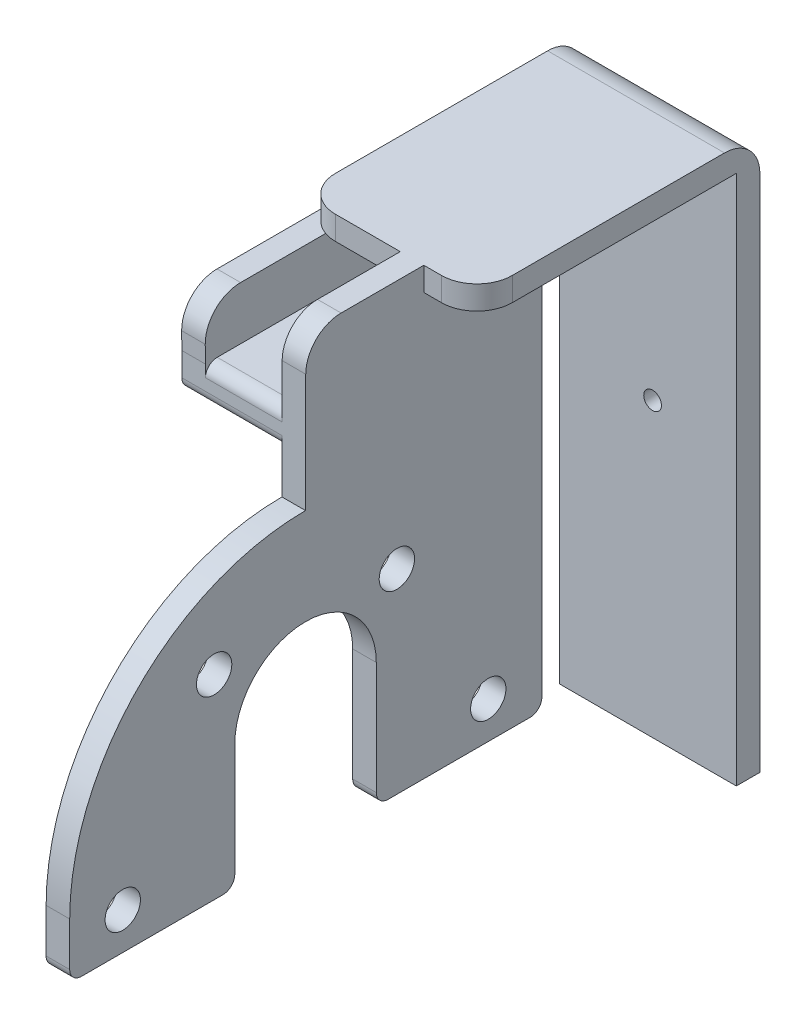
from build123d import *

# Parameters (mm, degrees)
BOSS_EXTRUDE1_DEPTH      = 2
BOSS_EXTRUDE2_DEPTH      = 2
SKETCH3_R                = 6.000000000000001
CUT_EXTRUDE1_DEPTH       = 2
SKETCH4_R                = 1.5000000000000009
SKETCH4_R_2              = 1.5000000000000042
CUT_EXTRUDE2_DEPTH       = 3
SKETCH5_R                = 1.5000000000000004
SKETCH5_R_2              = 1.5000000000000042
CUT_EXTRUDE3_DEPTH       = 3
CUT_EXTRUDE4_DEPTH       = 3
CUT_EXTRUDE5_DEPTH       = 3
CUT_EXTRUDE6_DEPTH       = 3
SKETCH9_R                = 1.5000000000000042
CUT_EXTRUDE8_DEPTH       = 3
SKETCH10_R               = 1.5000000000000042
CUT_EXTRUDE9_DEPTH       = 3
CUT_EXTRUDE10_DEPTH      = 240.38671642344738
CUT_EXTRUDE10_DEPTH_BACK = 240.38671642344738
SKETCH12_R               = 1.4999999999999998
SKETCH12_R_2             = 1.5000000000000002
SKETCH12_R_3             = 1.5000000000000013
SKETCH12_R_4             = 1.5
SKETCH12_R_5             = 1.5000000000000009
BOSS_EXTRUDE7_START      = 2
SKETCH13_R               = 1.5000000000000009
SKETCH13_R_2             = 1.5000000000000024
BOSS_EXTRUDE7_DEPTH      = 2
BOSS_EXTRUDE8_START      = -6.5
SKETCH14_W               = 24
SKETCH14_H               = 2
BOSS_EXTRUDE8_DEPTH      = 15
SKETCH15_W               = 15.000000000000007
SKETCH15_H               = 2
BOSS_EXTRUDE9_DEPTH      = 45
CUT_EXTRUDE11_DEPTH      = 243.1136096959442
SKETCH17_W               = 185.56969898313426
SKETCH17_H               = 96.24266996951368
CUT_EXTRUDE13_DEPTH      = 211.18448651258493
SKETCH18_R               = 1.5000000000000042
CUT_EXTRUDE14_DEPTH      = 10
BOSS_EXTRUDE10_DEPTH     = 8.5
FILLET1_R                = 3
FILLET2_R                = 3
FILLET3_R                = 3
SKETCH21_W               = 15.000000000000007
SKETCH21_H               = 44.000000000000014
SKETCH21_R               = 0.7499999999999987
BOSS_EXTRUDE11_DEPTH     = 2
BOSS_EXTRUDE12_DEPTH     = 2
FILLET4_R                = 3
FILLET5_R                = 1
FILLET6_R                = 1


with BuildPart() as part:
    # Sketch1 → Boss-Extrude1 (new body)
    with BuildSketch(Plane(origin=(0, 0, 0), x_dir=(1, 0, 0), z_dir=(0, 1, 0))):
        Polygon((55, -26.999999999999986), (55, 27.00000000000001), (-55, 26.999999999999996), (-55, -27), (-38.49999999999998, -134.00000000000006), (38.50000000000002, -134.00000000000003), align=None)
        Polygon((64.00000000000001, -159.00000000000003), (-63.99999999999996, -159.00000000000003), (-63.999999999999986, -134.00000000000006), (64, -134.00000000000003), align=None)
        Polygon((31.00000000000004, -159.00000000000006), (-30.99999999999999, -159.00000000000006), (-30.999999999999982, -172.00000000000006), (31.000000000000018, -172.00000000000006), align=None)
        Polygon((64.00000000000006, -172.00000000000003), (-64, -172.00000000000006), (-63.999999999999986, -203), (64.00000000000001, -203.00000000000003), align=None)
    extrude(amount=BOSS_EXTRUDE1_DEPTH)

    # Sketch2 → Boss-Extrude2 (add)
    with BuildSketch(Plane.ZY.offset(55)):
        with BuildLine():
            ThreePointArc((-22.999999999999996, 24), (-2.999999999999998, 44), (16.999999999999996, 24))
            Line((16.999999999999996, 24), (-22.999999999999996, 24))
        make_face()
        Polygon((-22.999999999999996, 24), (-22.999999999999996, 2.000000000000001), (17.000000000000004, 2.0000000000000053), (17.000000000000004, 24), align=None)
    boss_extrude2 = extrude(amount=-BOSS_EXTRUDE2_DEPTH)

    # Sketch3 → Cut-Extrude1 (cut)
    with BuildSketch(Plane.ZY.offset(55)):
        with Locations((-2.9999999999999956, 16)):
            Circle(SKETCH3_R)
    cut_extrude1 = extrude(amount=-CUT_EXTRUDE1_DEPTH, mode=Mode.SUBTRACT)

    # Mirror1: Boss-Extrude2 across plane
    add(boss_extrude2.mirror(Plane(origin=(0, 0, 0), x_dir=(0, 0, 1), z_dir=(1, 0, 0))))

    # Mirror2: Cut-Extrude1 across plane
    add(cut_extrude1.mirror(Plane(origin=(0, 0, 0), x_dir=(0, 0, 1), z_dir=(1, 0, 0))), mode=Mode.SUBTRACT)

    # Sketch4 → Cut-Extrude2 (cut)
    with BuildSketch(Plane(origin=(0, 2, 0), x_dir=(1, 0, 0), z_dir=(0, 1, 0))):
        with Locations(Location((-31.999999999999993, -32.999999999999986, 0), (0, 0, 270))):
            Circle(SKETCH4_R)
        with Locations(Location((-31.999999999999993, -103.00000000000001, 0), (0, 0, 270))):
            Circle(SKETCH4_R)
        with Locations(Location((32.00000000000001, -103, 0), (0, 0, 270))):
            Circle(SKETCH4_R_2)
        with Locations(Location((32.00000000000001, -32.999999999999964, 0), (0, 0, 270))):
            Circle(SKETCH4_R_2)
    extrude(amount=-CUT_EXTRUDE2_DEPTH, mode=Mode.SUBTRACT)

    # Sketch5 → Cut-Extrude3 (cut)
    with BuildSketch(Plane(origin=(0, 2, 0), x_dir=(1, 0, 0), z_dir=(0, 1, 0))):
        with Locations(Location((0, -196, 0), (0, 0, 270))):
            Circle(SKETCH5_R)
        with Locations(Location((-42, -196, 0), (0, 0, 270))):
            Circle(SKETCH5_R_2)
        with Locations(Location((42, -195.99999999999997, 0), (0, 0, 270))):
            Circle(SKETCH5_R_2)
    extrude(amount=-CUT_EXTRUDE3_DEPTH, mode=Mode.SUBTRACT)

    # Sketch6 → Cut-Extrude4 (cut)
    with BuildSketch(Plane(origin=(0, 2, 0), x_dir=(1, 0, 0), z_dir=(0, 1, 0))):
        with BuildLine():
            Line((-39, -172.00000000000006), (-39, -178.99999999999997))
            ThreePointArc((-39, -178.99999999999997), (-41.92893218813453, -186.0710678118655), (-49.00000000000007, -189.00000000000003))
            Line((-49.00000000000007, -189.00000000000003), (-63.999999999999986, -189.00000000000003))
            Line((-63.999999999999986, -189.00000000000003), (-64, -172.00000000000009))
            Line((-64, -172.00000000000009), (-39, -172.00000000000006))
        make_face()
        with BuildLine():
            Line((64, -172.00000000000009), (39, -172.00000000000009))
            Line((39, -172.00000000000009), (39, -179))
            ThreePointArc((39, -179), (41.928932188134524, -186.07106781186553), (49.00000000000007, -189.00000000000003))
            Line((49.00000000000007, -189.00000000000003), (63.999999999999986, -189.00000000000003))
            Line((63.999999999999986, -189.00000000000003), (64, -172.00000000000009))
        make_face()
    extrude(amount=-CUT_EXTRUDE4_DEPTH, mode=Mode.SUBTRACT)

    # Sketch7 → Cut-Extrude5 (cut)
    with BuildSketch(Plane(origin=(0, 2, 0), x_dir=(1, 0, 0), z_dir=(0, 1, 0))):
        with BuildLine():
            Line((-63.999999999999986, -203), (-50.09999999999989, -203))
            ThreePointArc((-50.09999999999989, -203), (-59.92878425849301, -198.92878425849304), (-63.99999999999999, -189.0999999999999))
            Line((-63.999999999999986, -189.0999999999999), (-63.999999999999986, -203))
        make_face()
        with BuildLine():
            ThreePointArc((64.00000000000001, -189.09999999999988), (59.92878425849304, -198.928784258493), (50.099999999999916, -203))
            Line((50.099999999999916, -203), (64.00000000000001, -203))
            Line((64.00000000000001, -203), (64.00000000000001, -189.09999999999988))
        make_face()
    extrude(amount=-CUT_EXTRUDE5_DEPTH, mode=Mode.SUBTRACT)

    # Sketch8 → Cut-Extrude6 (cut)
    with BuildSketch(Plane(origin=(0, 2, 0), x_dir=(1, 0, 0), z_dir=(0, 1, 0))):
        with BuildLine():
            Line((-31.149343986878943, -172.00000000000006), (-39, -172.00000000000006))
            Line((-39, -172.00000000000006), (-38.99999999999999, -178.99999999999997))
            ThreePointArc((-39, -178.99999999999997), (-39.00000430772996, -179.009281949184), (-39.00001723091613, -179.01856389037115))
            ThreePointArc((-39.00001723091618, -179.01856389037115), (-36.414638600380236, -174.01046074526764), (-31.149343986878943, -172.00000000000006))
        make_face()
        with BuildLine():
            Line((39, -179), (39, -172.00000000000009))
            Line((39.00000000000004, -172), (31.149343986878986, -172))
            ThreePointArc((31.149343986878986, -172), (36.41463860038014, -174.01046074526744), (39.00001723091619, -179.01856389037067))
            ThreePointArc((39.00001723091614, -179.01856389037067), (39.000004307729974, -179.00928194918376), (39.000000000000014, -179))
        make_face()
    extrude(amount=-CUT_EXTRUDE6_DEPTH, mode=Mode.SUBTRACT)

    # Sketch9 → Cut-Extrude8 (cut)
    with BuildSketch(Plane(origin=(0, 2, 0), x_dir=(1, 0, 0), z_dir=(0, 1, 0))):
        with BuildLine():
            Line((-65.7442014947963, -159.00000000000003), (-38.49999999999998, -159.00000000000003))
            Line((-38.49999999999998, -159.00000000000003), (-58.499999999999986, -153.64101615137747))
            ThreePointArc((-58.499999999999986, -153.64101615137747), (-63.97949441454555, -146.5), (-58.49999999999998, -139.35898384862253))
            Line((-58.49999999999998, -139.3589838486225), (-38.49999999999998, -134.00000000000009))
            Line((-38.49999999999998, -134.00000000000009), (-65.7442014947963, -134.00000000000009))
            Line((-65.7442014947963, -134.00000000000009), (-65.7442014947963, -159.00000000000003))
        make_face()
        with BuildLine():
            Line((38.49999999999998, -159.00000000000003), (65.55068988792617, -159.00000000000003))
            Line((65.55068988792617, -159.00000000000003), (65.55068988792617, -134.00000000000009))
            Line((65.55068988792617, -134.00000000000009), (38.49999999999998, -134.00000000000009))
            Line((38.49999999999998, -134.00000000000009), (58.49999999999998, -139.3589838486225))
            ThreePointArc((58.49999999999998, -139.35898384862253), (63.97949441454555, -146.5), (58.499999999999986, -153.64101615137747))
            Line((58.499999999999986, -153.64101615137747), (38.49999999999998, -159.00000000000003))
        make_face()
        with Locations(Location((-58.97949441454556, -146.5, 0), (0, 0, 270))):
            Circle(SKETCH9_R)
        with Locations(Location((-43.97949441454556, -140.5, 0), (0, 0, 270))):
            Circle(SKETCH9_R)
        with Locations(Location((-43.979494414545556, -152.5, 0), (0, 0, 270))):
            Circle(SKETCH9_R)
        with Locations(Location((43.979494414545556, -152.5, 0), (0, 0, 270))):
            Circle(SKETCH9_R)
        with Locations(Location((43.97949441454556, -140.5, 0), (0, 0, 270))):
            Circle(SKETCH9_R)
        with Locations(Location((58.97949441454556, -146.5, 0), (0, 0, 270))):
            Circle(SKETCH9_R)
    extrude(amount=-CUT_EXTRUDE8_DEPTH, mode=Mode.SUBTRACT)

    # Sketch10 → Cut-Extrude9 (cut)
    with BuildSketch(Plane(origin=(0, 2, 0), x_dir=(1, 0, 0), z_dir=(0, 1, 0))):
        with Locations(Location((-13.999999999999984, -122.97951269366077, 0), (0, 0, 270))):
            Circle(SKETCH10_R)
        with Locations(Location((-13.99999999999998, -132.97951269366075, 0), (0, 0, 270))):
            Circle(SKETCH10_R)
        with Locations(Location((34.000000000000014, -122.97951269366077, 0), (0, 0, 270))):
            Circle(SKETCH10_R)
        with Locations(Location((34.000000000000014, -132.97951269366075, 0), (0, 0, 270))):
            Circle(SKETCH10_R)
    extrude(amount=-CUT_EXTRUDE9_DEPTH, mode=Mode.SUBTRACT)

    # Sketch12 → Cut-Extrude10 (cut, two sides: drawn at the far end of the back side and taken through both)
    with BuildSketch(Plane(origin=(55, 0, 0), x_dir=(0, 0, -1), z_dir=(1, 0, 0)).offset(-CUT_EXTRUDE10_DEPTH_BACK)):
        with Locations((-4.750000000000004, 9.000000000000002)):
            Circle(SKETCH12_R)
        with Locations((10.749999999999996, 9.000000000000007)):
            Circle(SKETCH12_R_2)
        with BuildLine():
            ThreePointArc((8.999999999999975, 29.840000000000014), (2.9999999999999827, 35.83999999999998), (-3.000000000000003, 29.840000000000007))
            Line((-3.000000000000004, 29.840000000000007), (-3.0000000000000053, 16))
            ThreePointArc((-3.000000000000004, 16), (2.9999999999999964, 10), (8.999999999999998, 16))
            Line((8.999999999999998, 16), (8.999999999999973, 29.840000000000014))
        make_face()
        with Locations((-4.750000000000004, 35.84)):
            Circle(SKETCH12_R_3)
        with Locations((10.749999999999996, 35.84000000000001)):
            Circle(SKETCH12_R_4)
        with Locations((-12.500000000000004, 22.42)):
            Circle(SKETCH12_R_5)
        with Locations((18.499999999999996, 22.42000000000001)):
            Circle(SKETCH12_R_5)
    extrude(amount=CUT_EXTRUDE10_DEPTH + CUT_EXTRUDE10_DEPTH_BACK, mode=Mode.SUBTRACT)

    # Sketch13 → Boss-Extrude7 (add)
    # profile 1 of 2: a face of its own
    with BuildSketch(Plane(origin=(55, 0, 0), x_dir=(0, 0, -1), z_dir=(1, 0, 0)).offset(BOSS_EXTRUDE7_START)):
        with BuildLine():
            Line((-17.000000000000004, 24), (-17.000000000000004, 19.28348423041724))
            Line((-17.000000000000004, 19.28348423041724), (-3.0000000000000053, 19.28348423041724))
            Line((-3.000000000000005, 19.28348423041724), (-3.000000000000004, 29.840000000000007))
            ThreePointArc((-3.000000000000006, 29.840000000000007), (2.9999999999999787, 35.84), (8.999999999999972, 29.840000000000014))
            Line((8.999999999999973, 29.840000000000014), (8.999999999999993, 19.28348423041724))
            Line((8.999999999999993, 19.28348423041724), (22.999999999999996, 19.283484230417237))
            Line((22.999999999999996, 19.283484230417237), (22.999999999999996, 24))
            ThreePointArc((22.999999999999996, 24), (17.142135623730947, 38.14213562373095), (2.999999999999998, 44))
            ThreePointArc((2.999999999999998, 44), (-11.142135623730953, 38.14213562373095), (-17.000000000000004, 24.000000000000004))
        make_face()
        with Locations((-12.500000000000004, 22.42)):
            Circle(SKETCH13_R, mode=Mode.SUBTRACT)
        with Locations((18.499999999999996, 22.42000000000001)):
            Circle(SKETCH13_R, mode=Mode.SUBTRACT)
        with Locations((-4.750000000000004, 35.84)):
            Circle(SKETCH13_R, mode=Mode.SUBTRACT)
        with Locations((10.749999999999996, 35.84000000000001)):
            Circle(SKETCH13_R_2, mode=Mode.SUBTRACT)
    # profile 2 of 2: a face of its own
    with BuildSketch(Plane(origin=(55, 0, 0), x_dir=(0, 0, -1), z_dir=(1, 0, 0)).offset(BOSS_EXTRUDE7_START)):
        with BuildLine():
            Line((22.999999999999996, 24), (22.999999999999996, 19.283484230417237))
            Line((22.999999999999996, 19.283484230417237), (23.046815154055327, 19.283484230417237))
            Line((23.046815154055327, 19.283484230417237), (23.04681515405532, 57))
            Line((23.04681515405532, 57), (3.0234075770276583, 57))
            Line((3.023407577027657, 57), (2.999999999999997, 44))
            ThreePointArc((2.999999999999998, 44), (17.142135623730947, 38.14213562373095), (22.999999999999996, 24))
        make_face()
    extrude(amount=-BOSS_EXTRUDE7_DEPTH)

    # Sketch14 → Boss-Extrude8 (add)
    with BuildSketch(Plane.ZY.offset(-55).offset(BOSS_EXTRUDE8_START)):
        with Locations((-25.03511136554149, 56.00000000000001)):
            Rectangle(SKETCH14_W, SKETCH14_H)
    extrude(amount=BOSS_EXTRUDE8_DEPTH)

    # Sketch15 → Boss-Extrude9 (add)
    with BuildSketch(Plane.XZ.offset(-55)):
        with Locations((54, -36.03511136554149)):
            Rectangle(SKETCH15_W, SKETCH15_H)
    extrude(amount=BOSS_EXTRUDE9_DEPTH)

    # Sketch16 → Cut-Extrude11 (cut, through all)
    with BuildSketch(Plane.ZY.offset(-55)):
        Polygon((-35.92021187003197, 46.46920068706199), (-36.717575013579555, -14.58603430458196), (219.6312484084681, -17.93387341643705), (219.6312484084681, 46.469200687062), align=None)
    extrude(amount=CUT_EXTRUDE11_DEPTH, mode=Mode.SUBTRACT)


with BuildPart() as cut_extrude11_piece_1:
    # of the separate pieces the step leaves, piece 1, a body of its own (cut_extrude11_pieces)
    add(part.part.solids().sort_by_distance((57, 19.28348423, -9))[0])

    # Sketch18 → Cut-Extrude14 (cut)
    with BuildSketch(Plane(origin=(0, 0, -37.03511136554149), x_dir=(-1, 0, 0), z_dir=(0, 0, -1))):
        with Locations((-54.4, 34.78000000000001)):
            Circle(SKETCH18_R)
    extrude(amount=-CUT_EXTRUDE14_DEPTH, mode=Mode.SUBTRACT)

    # Sketch19 → Boss-Extrude10 (add)
    with BuildSketch(Plane.ZY.offset(-55)):
        with BuildLine():
            Line((-3.0117037885138274, 50.5), (-3.006302039968982, 47.5))
            Line((-3.006302039968982, 47.5), (-16.04681515405532, 47.50000000000001))
            ThreePointArc((-16.04681515405532, 47.50000000000001), (-18.875242278801508, 46.32842712474619), (-20.04681515405532, 43.5))
            Line((-20.04681515405532, 43.5), (-20.04681515405532, 41.96229343982267))
            ThreePointArc((-20.04681515405532, 41.96229343982267), (-20.339708372868774, 41.25518665863612), (-21.046815154055327, 40.962293439822666))
            Line((-21.046815154055327, 40.962293439822666), (-22.046815154055313, 40.962293439822666))
            ThreePointArc((-22.046815154055313, 40.962293439822666), (-22.75392193524187, 41.25518665863611), (-23.046815154055324, 41.96229343982267))
            Line((-23.046815154055324, 41.96229343982267), (-23.046815154055317, 46.5))
            ThreePointArc((-23.046815154055317, 46.5), (-21.875242278801515, 49.3284271247462), (-19.04681515405532, 50.50000000000001))
            Line((-19.04681515405532, 50.50000000000001), (-3.0117037885138274, 50.5))
        make_face()
    extrude(amount=BOSS_EXTRUDE10_DEPTH)

    # Fillet1
    fillet1_edges = [cut_extrude11_piece_1.edges().sort_by_distance(p)[0] for p in [
        (56, 57, -3.0234075770276574),
    ]]
    fillet(fillet1_edges, radius=FILLET1_R)

    # Fillet2
    fillet2_edges = [cut_extrude11_piece_1.edges().sort_by_distance(p)[0] for p in [
        (61.5, 56, -13.035111365541487),
        (46.5, 56, -13.035111365541487),
    ]]
    fillet(fillet2_edges, radius=FILLET2_R)

    # Fillet3
    fillet3_edges = [cut_extrude11_piece_1.edges().sort_by_distance(p)[0] for p in [
        (54, 57.00000000000001, -37.03511136554149),
    ]]
    fillet(fillet3_edges, radius=FILLET3_R)

    # Sketch21 → Boss-Extrude11 (add)
    with BuildSketch(Plane(origin=(0, 0, -37.03511136554149), x_dir=(-1, 0, 0), z_dir=(0, 0, -1))):
        with Locations((-54, 32)):
            Rectangle(SKETCH21_W, SKETCH21_H)
        with Locations((-54.4, 34.78000000000001)):
            Circle(SKETCH21_R, mode=Mode.SUBTRACT)
    extrude(amount=-BOSS_EXTRUDE11_DEPTH)

    # Sketch22 → Boss-Extrude12 (add)
    with BuildSketch(Plane.ZY.offset(-46.5)):
        with BuildLine():
            Line((-16.035111365541486, 55), (-23.04681515405532, 55))
            Line((-23.04681515405532, 55), (-23.046815154055324, 46.5))
            ThreePointArc((-23.046815154055317, 46.5), (-21.875242278801515, 49.3284271247462), (-19.04681515405532, 50.50000000000001))
            Line((-19.04681515405532, 50.50000000000001), (-3.0117037885138274, 50.5))
            Line((-3.0117037885138274, 50.5), (-2.958554912067868, 55))
            Line((-2.958554912067868, 55), (-16.035111365541486, 55))
        make_face()
    extrude(amount=-BOSS_EXTRUDE12_DEPTH)

    # Fillet4
    fillet4_edges = [cut_extrude11_piece_1.edges().sort_by_distance(p)[0] for p in [
        (47.5, 55, -2.958554912067868),
    ]]
    fillet(fillet4_edges, radius=FILLET4_R)

    # Fillet5
    fillet5_edges = [cut_extrude11_piece_1.edges().sort_by_distance(p)[0] for p in [
        (51.75, 50.5, -3.0117037885138274),
        (50.75, 47.5, -3.006302039968982),
    ]]
    fillet(fillet5_edges, radius=FILLET5_R)

    # Fillet6
    fillet6_edges = [cut_extrude11_piece_1.edges().sort_by_distance(p)[0] for p in [
        (56, 19.283484230417237, -23.046815154055327),
        (56, 19.28348423041724, -8.999999999999993),
        (56, 19.28348423041724, 17.000000000000004),
        (56, 19.28348423041724, 3.0000000000000053),
    ]]
    fillet(fillet6_edges, radius=FILLET6_R)


with BuildPart() as cut_extrude11_piece_2:
    # of the separate pieces the step leaves, piece 2, a body of its own (cut_extrude11_pieces)
    add(part.part.solids().sort_by_distance((55, 0, 138.421161675))[0])


with BuildPart() as cut_extrude11_piece_3:
    # of the separate pieces the step leaves, piece 3, a body of its own (cut_extrude11_pieces)
    add(part.part.solids().sort_by_distance((55, 0, 189))[0])


with BuildPart() as cut_extrude13_tool:
    # Sketch17 → Cut-Extrude13 (new, through all)
    with BuildSketch(Plane.ZY.offset(-55)):
        with Locations((121.69980384064316, 40.02606825982201)):
            Rectangle(SKETCH17_W, SKETCH17_H)
    extrude(amount=-CUT_EXTRUDE13_DEPTH)


with BuildPart() as cut_extrude11_piece_2_1:
    add(cut_extrude11_piece_2.part)

    # Cut-Extrude13: cut by cut_extrude13_tool
    add(cut_extrude13_tool.part, mode=Mode.SUBTRACT)


with BuildPart() as cut_extrude11_piece_3_1:
    add(cut_extrude11_piece_3.part)

    # Cut-Extrude13: cut by cut_extrude13_tool
    add(cut_extrude13_tool.part, mode=Mode.SUBTRACT)


solid = cut_extrude11_piece_1.part
